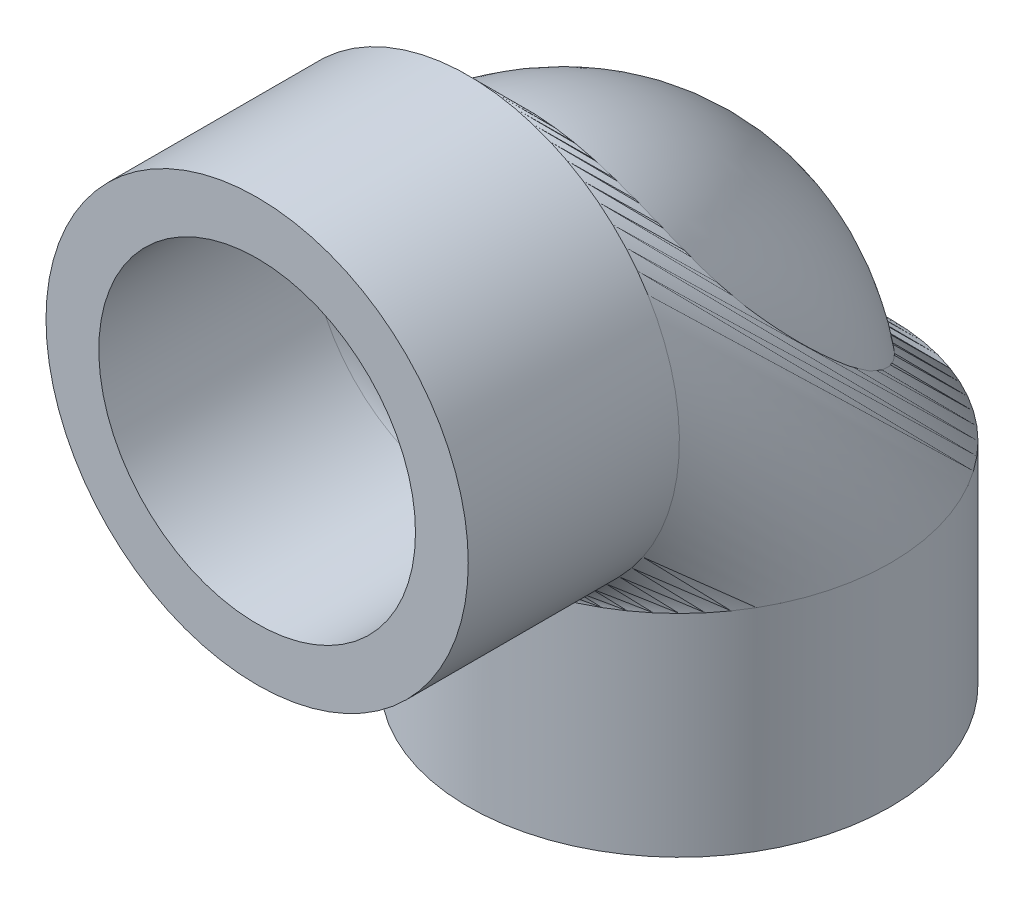
from build123d import *

# Parameters (mm, degrees)
SKETCH_1_R = 10
SKETCH_3_R = 7.5


with BuildPart() as part:
    # Sweep 1: sweep along a path in 草图2
    with BuildLine(Plane(origin=(0, 0, 0), x_dir=(0, 0, -1), z_dir=(1, 0, 0))) as sweep_1_path:
        Line((0, 0), (10, 0))
        ThreePointArc((10, 0), (17.071067812, -2.928932188), (20, -10))
        Line((20, -10), (20, -20))
    # 草图1 → Sweep 1 (sweep)
    with BuildSketch(Plane.XY):
        Circle(SKETCH_1_R)
    sweep(path=sweep_1_path.line)

    # Sweep 1 2: sweep along a path in 草图4
    with BuildLine(Plane(origin=(0, 0, 0), x_dir=(0, 0, -1), z_dir=(1, 0, 0))) as sweep_1_2_path:
        Line((0, 0), (10, 0))
        ThreePointArc((10, 0), (17.071067812, -2.928932188), (20, -10))
        Line((20, -10), (20, -20))
    # 草图3 → Sweep 1 2 (sweep, cut)
    with BuildSketch(Plane.XY):
        Circle(SKETCH_3_R)
    sweep(path=sweep_1_2_path.line, mode=Mode.SUBTRACT)


solid = part.part
